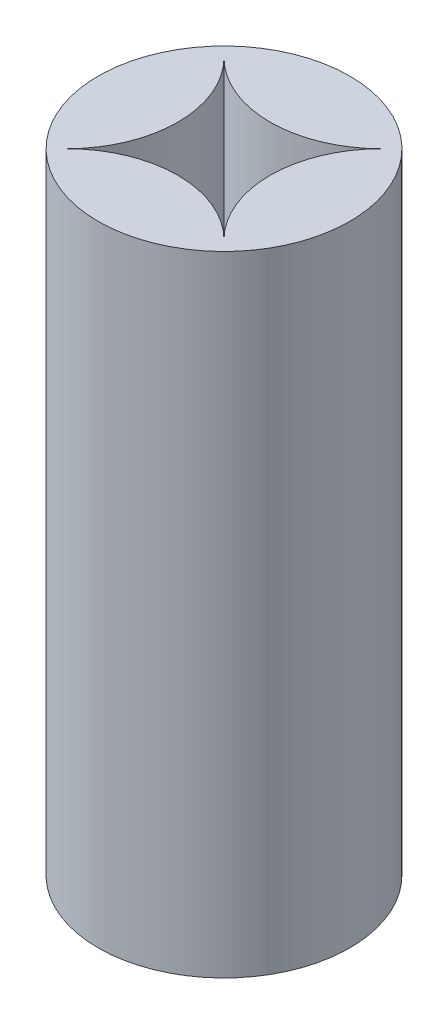
from build123d import *

# Parameters (mm, degrees)
SKETCH1_R           = 4
BOSS_EXTRUDE1_DEPTH = 20
CUT_EXTRUDE1_DEPTH  = 10


with BuildPart() as part:
    # Sketch1 → Boss-Extrude1 (new body)
    with BuildSketch(Plane(origin=(0, 0, 0), x_dir=(1, 0, 0), z_dir=(0, 1, 0))):
        with Locations(Location((0, 0, 0), (0, 0, 270))):
            Circle(SKETCH1_R)
    extrude(amount=BOSS_EXTRUDE1_DEPTH)

    # Sketch2 → Cut-Extrude1 (cut)
    with BuildSketch(Plane(origin=(0, 20, 0), x_dir=(1, 0, 0), z_dir=(0, 1, 0))):
        with BuildLine():
            ThreePointArc((2.5, 2.5), (0, 1.464466094), (-2.5, 2.5))
            ThreePointArc((-2.5, 2.5), (-1.464466094, 0), (-2.5, -2.5))
            ThreePointArc((-2.5, -2.5), (0, -1.464466094), (2.5, -2.5))
            ThreePointArc((2.5, -2.5), (1.464466094, 0), (2.5, 2.5))
        make_face()
    extrude(amount=-CUT_EXTRUDE1_DEPTH, mode=Mode.SUBTRACT)


solid = part.part
